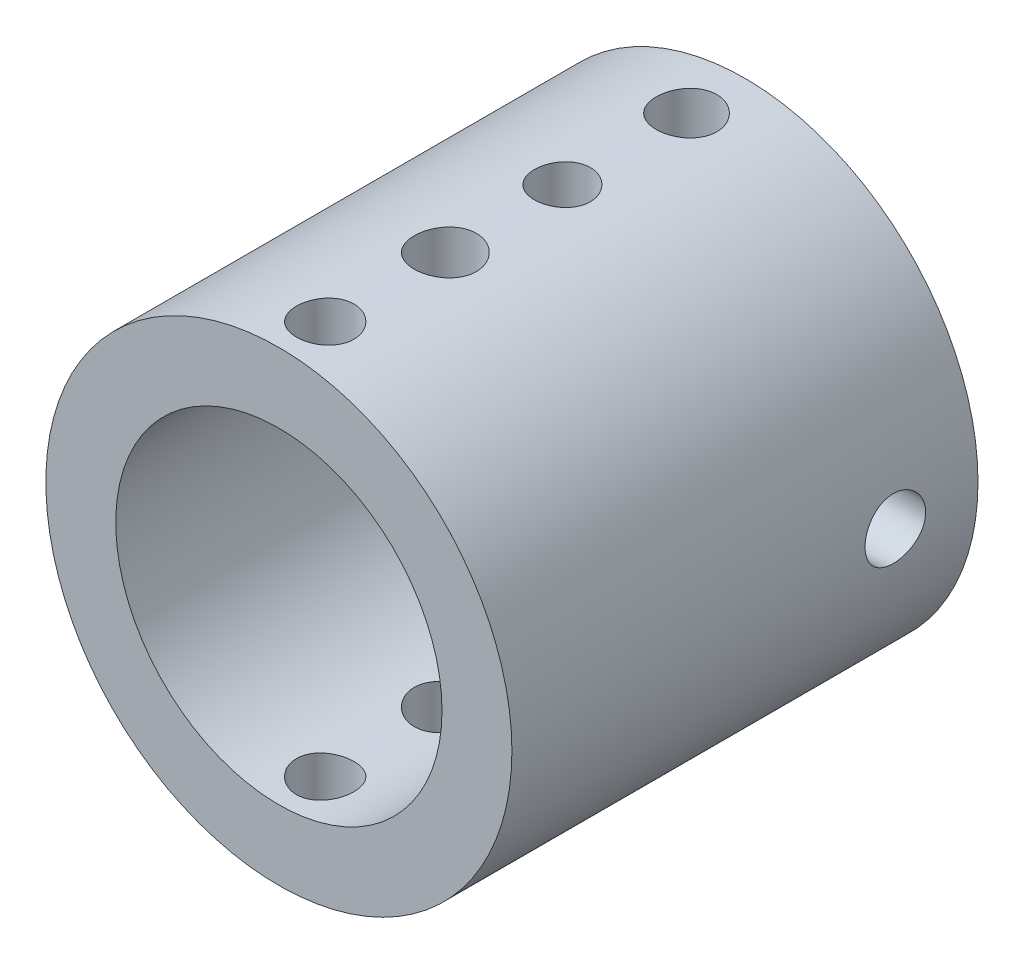
from build123d import *

# Parameters (mm, degrees)
ESQUISSE1_R                  = 15
ESQUISSE1_R_2                = 10.5
BOSS_EXTRU_1_DEPTH           = 30
ENL_V_MAT_EXTRU_1_DEPTH      = 37.742346142
ENL_V_MAT_EXTRU_1_DEPTH_BACK = 37.742346142
ESQUISSE2_R                  = 1.95
ENL_V_MAT_EXTRU_2_DEPTH      = 37.742346305
ENL_V_MAT_EXTRU_2_DEPTH_BACK = 37.742346305
ESQUISSE3_R                  = 1.8
ENL_V_MAT_EXTRU_3_DEPTH      = 37.742346305
ENL_V_MAT_EXTRU_3_DEPTH_BACK = 37.742346305
ESQUISSE4_R                  = 2
ENL_V_MAT_EXTRU_4_DEPTH      = 37.742346305
ENL_V_MAT_EXTRU_4_DEPTH_BACK = 37.742346305
ESQUISSE5_R                  = 1.85
ENL_V_MAT_EXTRU_5_DEPTH      = 37.742346305
ENL_V_MAT_EXTRU_5_DEPTH_BACK = 37.742346305
ESQUISSE6_R                  = 1.95


with BuildPart() as part:
    # Esquisse1 → Boss.-Extru.1 (new body)
    with BuildSketch(Plane.XY):
        Circle(ESQUISSE1_R)
        Circle(ESQUISSE1_R_2, mode=Mode.SUBTRACT)
    extrude(amount=BOSS_EXTRU_1_DEPTH)

    # Esquisse2 → Enlèv. mat.-Extru.1 (cut, two sides: drawn at the far end of the back side and taken through both)
    with BuildSketch(Plane(origin=(0, 0, 0), x_dir=(1, 0, 0), z_dir=(0, 1, 0)).offset(-ENL_V_MAT_EXTRU_1_DEPTH_BACK)):
        with Locations(Location((0, -3.761693036, 0), (0, 0, 270))):
            Circle(ESQUISSE2_R)
    extrude(amount=ENL_V_MAT_EXTRU_1_DEPTH + ENL_V_MAT_EXTRU_1_DEPTH_BACK, mode=Mode.SUBTRACT)

    # Esquisse3 → Enlèv. mat.-Extru.2 (cut, two sides: drawn at the far end of the back side and taken through both)
    with BuildSketch(Plane(origin=(0, 0, 0), x_dir=(1, 0, 0), z_dir=(0, 1, 0)).offset(-ENL_V_MAT_EXTRU_2_DEPTH_BACK)):
        with Locations(Location((0, -11.751934404, 0), (0, 0, 270))):
            Circle(ESQUISSE3_R)
    extrude(amount=ENL_V_MAT_EXTRU_2_DEPTH + ENL_V_MAT_EXTRU_2_DEPTH_BACK, mode=Mode.SUBTRACT)

    # Esquisse4 → Enlèv. mat.-Extru.3 (cut, two sides: drawn at the far end of the back side and taken through both)
    with BuildSketch(Plane(origin=(0, 0, 0), x_dir=(1, 0, 0), z_dir=(0, 1, 0)).offset(-ENL_V_MAT_EXTRU_3_DEPTH_BACK)):
        with Locations(Location((0, -19.287446587, 0), (0, 0, 270))):
            Circle(ESQUISSE4_R)
    extrude(amount=ENL_V_MAT_EXTRU_3_DEPTH + ENL_V_MAT_EXTRU_3_DEPTH_BACK, mode=Mode.SUBTRACT)

    # Esquisse5 → Enlèv. mat.-Extru.4 (cut, two sides: drawn at the far end of the back side and taken through both)
    with BuildSketch(Plane(origin=(0, 0, 0), x_dir=(1, 0, 0), z_dir=(0, 1, 0)).offset(-ENL_V_MAT_EXTRU_4_DEPTH_BACK)):
        with Locations(Location((0, -27.017842707, 0), (0, 0, 270))):
            Circle(ESQUISSE5_R)
    extrude(amount=ENL_V_MAT_EXTRU_4_DEPTH + ENL_V_MAT_EXTRU_4_DEPTH_BACK, mode=Mode.SUBTRACT)

    # Esquisse6 → Enlèv. mat.-Extru.5 (cut, two sides: drawn at the far end of the back side and taken through both)
    with BuildSketch(Plane(origin=(0, 0, 0), x_dir=(0, 0, -1), z_dir=(1, 0, 0)).offset(-ENL_V_MAT_EXTRU_5_DEPTH_BACK)):
        with Locations((-5.320764522, 0)):
            Circle(ESQUISSE6_R)
    extrude(amount=ENL_V_MAT_EXTRU_5_DEPTH + ENL_V_MAT_EXTRU_5_DEPTH_BACK, mode=Mode.SUBTRACT)


solid = part.part
